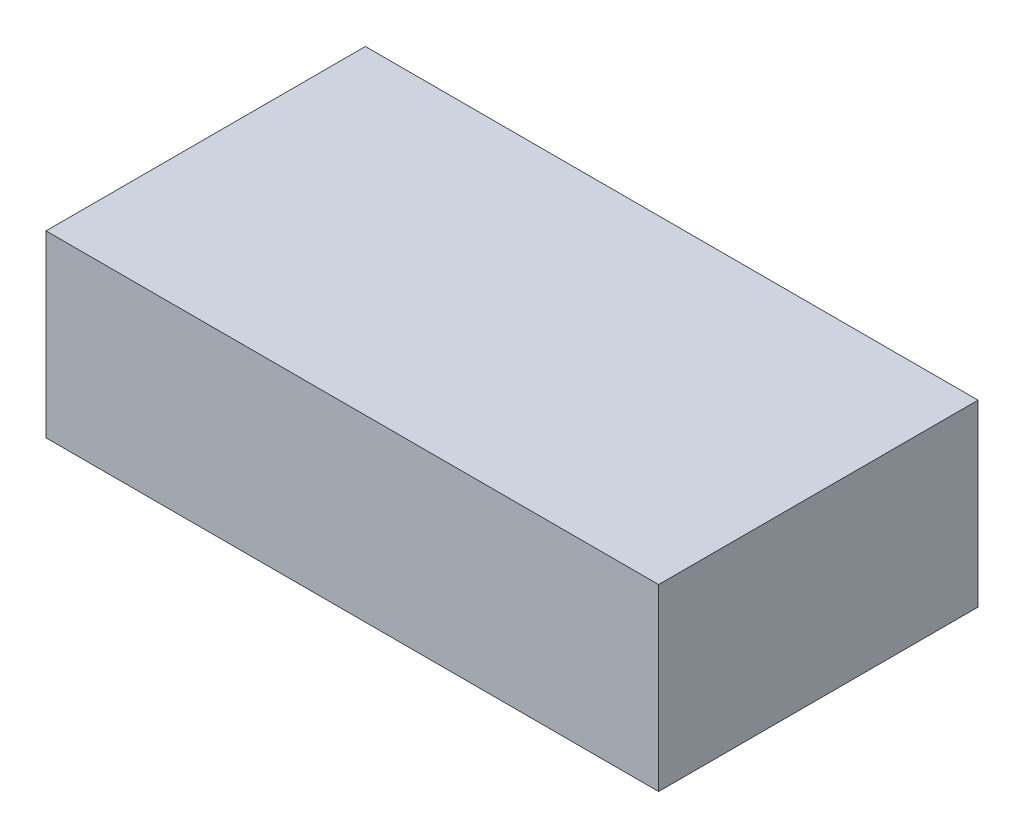
from build123d import *

# Parameters (mm, degrees)
SKETCH_3_W      = 222.5
SKETCH_3_H      = 65.1
EXTRUDE_1_DEPTH = 116


with BuildPart() as part:
    # 草图3 → 凸台-拉伸1 (new body)
    with BuildSketch(Plane.XY):
        Rectangle(SKETCH_3_W, SKETCH_3_H)
    extrude(amount=EXTRUDE_1_DEPTH)


solid = part.part
